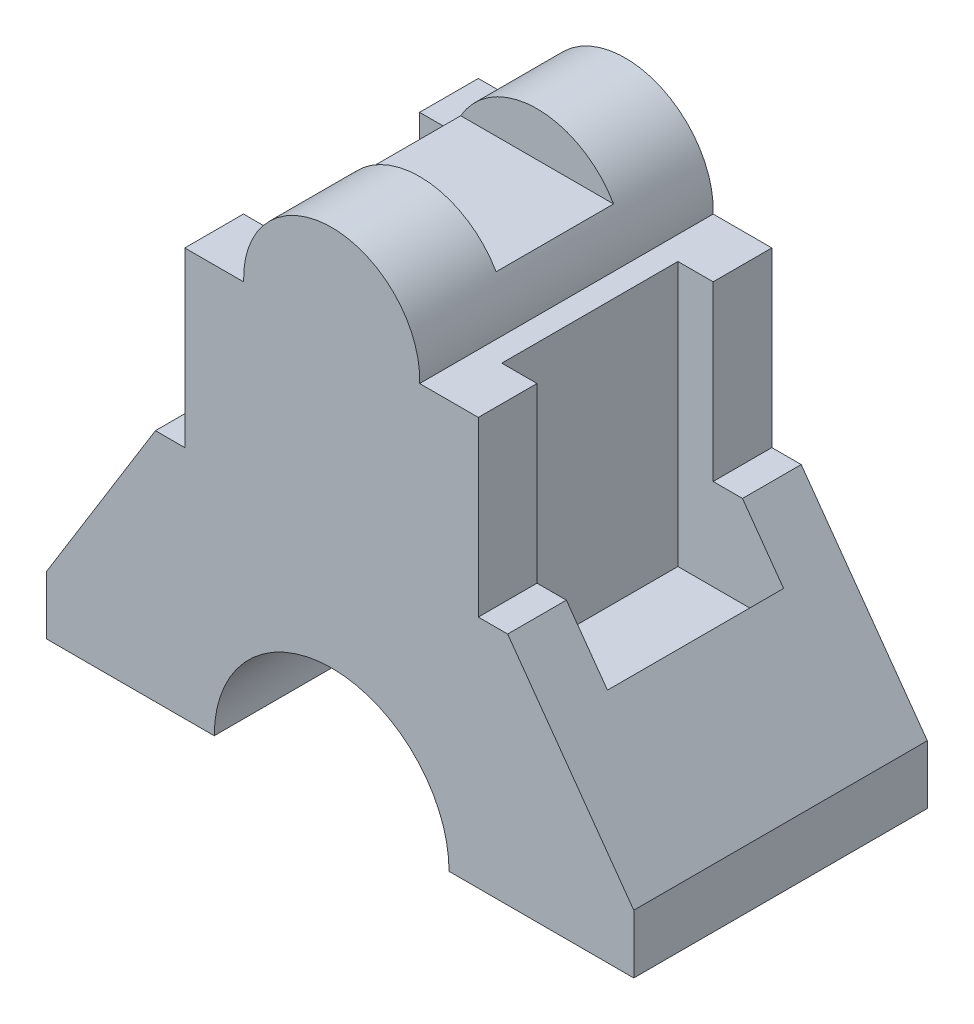
from build123d import *

# Parameters (mm, degrees)
BOSS_EXTRUDE1_DEPTH = 25
SKETCH3_W           = 6
SKETCH3_H           = 30
SKETCH3_W_2         = 12
CUT_EXTRUDE2_DEPTH  = 45
SKETCH4_W           = 41.759295091
SKETCH4_H           = 20
CUT_EXTRUDE4_DEPTH  = 7


with BuildPart() as part:
    # Sketch1 → Boss-Extrude1 (new, symmetric)
    with BuildSketch(Plane.XY):
        with BuildLine():
            Line((9.225854521, 69.458085549), (-0.764451304, 69.458085549))
            ThreePointArc((-0.764451304, 69.458085549), (-15.754659065, 85), (-30.744866826, 69.458085549))
            Line((-30.744866826, 69.458085549), (-40.774145479, 69.458085549))
            Line((-40.774145479, 69.458085549), (-40.774145479, 40))
            Line((-40.774145479, 40), (-45.774145479, 40))
            Line((-45.774145479, 40), (-64.293941681, 10))
            Line((-64.293941681, 10), (-64.293941681, 0))
            Line((-64.293941681, 0), (-35.754659065, 0))
            ThreePointArc((-35.754659065, 0), (-15.754659065, 20), (4.245340935, 0))
            Line((4.245340935, 0), (35.706058319, 0))
            Line((35.706058319, 0), (35.706058319, 10))
            Line((35.706058319, 10), (14.225854521, 40))
            Line((14.225854521, 40), (9.225854521, 40))
            Line((9.225854521, 40), (9.225854521, 69.458085549))
        make_face()
    extrude(amount=BOSS_EXTRUDE1_DEPTH, both=True)

    # Sketch3 → Cut-Extrude2 (cut)
    with BuildSketch(Plane(origin=(0, 69.458085549, 0), x_dir=(1, 0, 0), z_dir=(0, 1, 0))):
        with Locations((6.225854521, 0)):
            Rectangle(SKETCH3_W, SKETCH3_H)
        with Locations((15.225854521, 0)):
            Rectangle(SKETCH3_W_2, SKETCH3_H)
    cut_extrude2 = extrude(amount=-CUT_EXTRUDE2_DEPTH, mode=Mode.SUBTRACT)

    # Mirror1: Cut-Extrude2 across plane
    add(cut_extrude2.mirror(Plane.ZY.offset(14.293941681)), mode=Mode.SUBTRACT)

    # Sketch4 → Cut-Extrude4 (cut, symmetric)
    with BuildSketch(Plane(origin=(0, 84.458085549, 0), x_dir=(1, 0, 0), z_dir=(0, 1, 0))):
        with Locations((-15.754659066, 0)):
            Rectangle(SKETCH4_W, SKETCH4_H)
    extrude(amount=CUT_EXTRUDE4_DEPTH, both=True, mode=Mode.SUBTRACT)


solid = part.part
